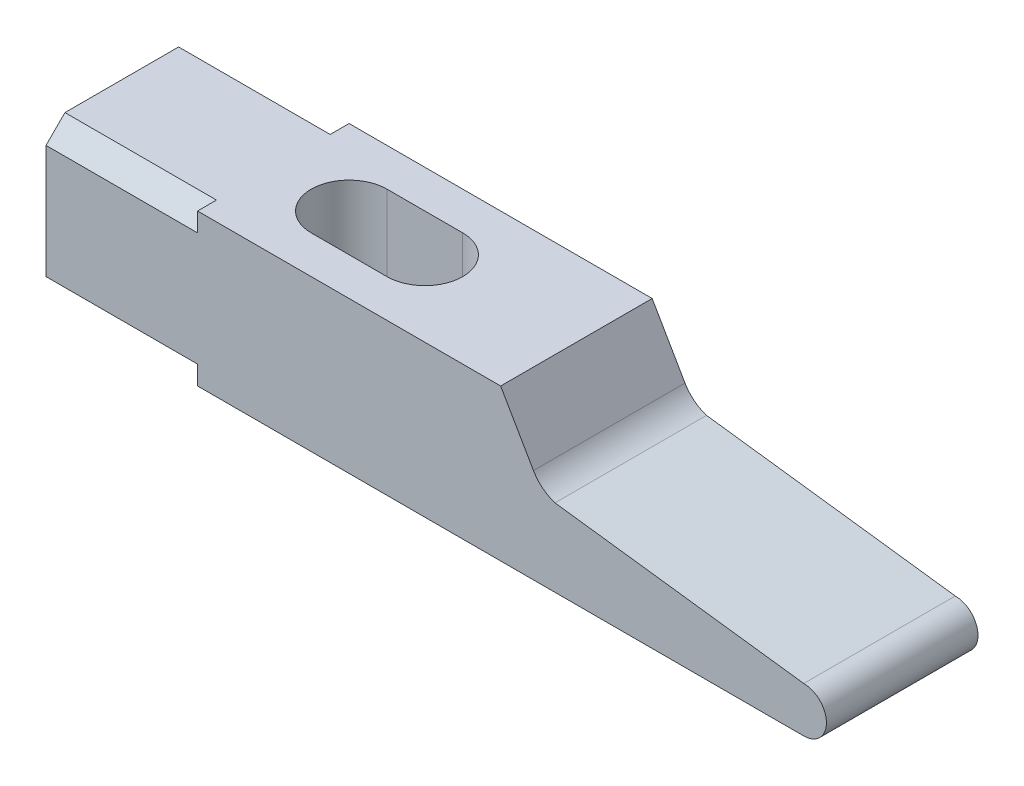
from build123d import *

# Parameters (mm, degrees)
EXTRUDE_1_DEPTH     = 10
CUT_EXTRUDE_1_DEPTH = 106.399240984
CUT_EXTRUDE_2_DEPTH = 20


with BuildPart() as part:
    # 草图1 → 凸台-拉伸1 (new, symmetric)
    with BuildSketch(Plane.XY):
        with BuildLine():
            Line((0, 0), (0, 20))
            Line((0, 20), (60, 20))
            Line((60, 20), (64.330127019, 12.5))
            ThreePointArc((64.330127019, 12.5), (65.537347332, 11.095201195), (67.173135447, 10.226272076))
            Line((67.173135447, 10.226272076), (100, 6))
            ThreePointArc((100, 6), (103, 3), (100, 0))
            Line((100, 0), (0, 0))
        make_face()
    extrude(amount=EXTRUDE_1_DEPTH, both=True)

    # 草图2 → 切除-拉伸1 (cut, through all)
    with BuildSketch(Plane(origin=(0, 20, 0), x_dir=(1, 0, 0), z_dir=(0, 1, 0))):
        with BuildLine():
            Line((30, 5), (40, 5))
            ThreePointArc((40, 5), (45, 0), (40, -5))
            Line((40, -5), (30, -5))
            ThreePointArc((30, -5), (25, 0), (30, 5))
        make_face()
    extrude(amount=-CUT_EXTRUDE_1_DEPTH, mode=Mode.SUBTRACT)

    # 草图3 → 切除-拉伸2 (cut)
    with BuildSketch(Plane.ZY):
        Polygon((-10, 17.5), (-7.5, 20), (-10, 20), align=None)
        Polygon((10, 20), (7.5, 20), (10, 17.5), align=None)
        Polygon((10, 0), (10, 2.5), (7.5, 0), align=None)
        Polygon((-7.5, 0), (-10, 2.5), (-10, 0), align=None)
    extrude(amount=-CUT_EXTRUDE_2_DEPTH, mode=Mode.SUBTRACT)


solid = part.part
